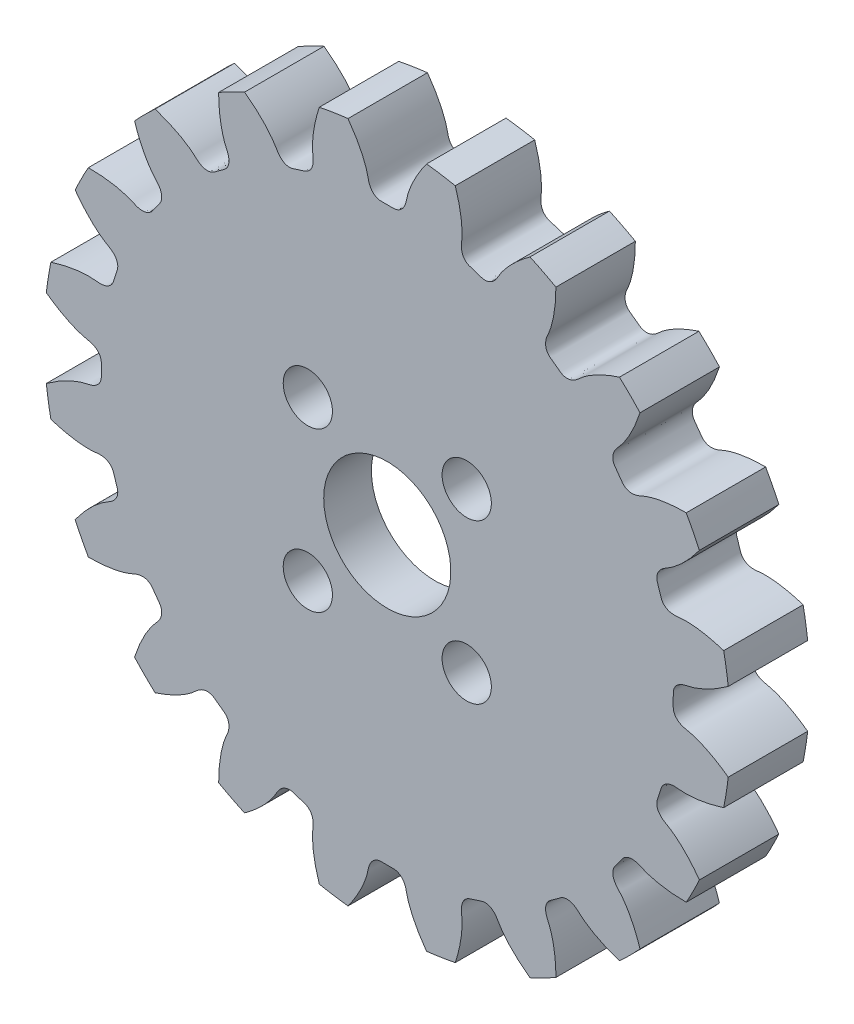
from build123d import *

# Parameters (mm, degrees)
SKETCHREVOLVESPURGEAR1_W       = 20
SKETCHREVOLVESPURGEAR1_H       = 21.599999676
TOOTHEXTRUDECUTSPURGEAR1_DEPTH = 10
PATTERNSPURGEAR1_COUNT         = 20
BOREREVOLVESKETCH_W            = 20
BOREREVOLVESKETCH_H            = 5
SKETCH_5_R                     = 5
EXTRUDE_1_DEPTH                = 10
SKETCH_6_R                     = 21.599999676
CUT_EXTRUDE_3_DEPTH            = 15
SKETCH_8_R                     = 10.5
CUT_EXTRUDE_4_DEPTH            = 2
SKETCH_9_R                     = 1.55
SKETCH_9_R_2                   = 4
CUT_EXTRUDE_6_DEPTH            = 31.494177986


with BuildPart() as part:
    # SketchRevolveSpurGear1 → SpurGear1 (revolve)
    with BuildSketch(Plane(origin=(0, 0, 0), x_dir=(0, 0, -1), z_dir=(1, 0, 0))):
        with Locations((0, 10.799999838)):
            Rectangle(SKETCHREVOLVESPURGEAR1_W, SKETCHREVOLVESPURGEAR1_H)
    revolve(axis=Axis((0, 0, 0), (0, 0, -1)))

    # SketchToothSpurGear1 → ToothExtrudeCutSpurGear1 (cut, symmetric)
    with BuildSketch(Plane.XY):
        with BuildLine():
            ThreePointArc((21.532230647, 2.526940688), (21.679999674, 0), (21.532230647, -2.526940688))
            add(Edge.make_bspline(
                [(21.532230647, -2.526940688), (21.301390631, -2.355599127), (20.993144013, -2.145043773), (20.604048565, -1.912590907), (20.393800428, -1.795045634), (20.194039766, -1.690777215), (20.00534497, -1.59908019), (19.828262151, -1.519226163), (19.663304554, -1.450466874), (19.510951931, -1.392032618), (19.371649371, -1.343142192), (19.245808271, -1.302976738), (19.133800685, -1.270767763), (19.035974432, -1.245531154), (18.869684481, -1.208311641), (18.704798317, -1.178558703), (18.546736061, -1.119890043), (18.463392394, -1.082598154), (18.380456666, -1.036979758), (18.296968655, -0.980015425), (18.212792281, -0.906884989), (18.130131288, -0.811131279), (18.056248596, -0.686346334), (18.007102294, -0.538421983), (17.987222236, -0.30506447), (18.009084117, 0), (17.987222236, 0.30506447), (18.007102294, 0.538421983), (18.056248596, 0.686346334), (18.130131288, 0.811131279), (18.212792281, 0.906884989), (18.296968655, 0.980015425), (18.380456666, 1.036979758), (18.463392394, 1.082598154), (18.546736061, 1.119890043), (18.704798317, 1.178558703), (18.869684481, 1.208311641), (19.035974432, 1.245531154), (19.133800685, 1.270767763), (19.245808271, 1.302976738), (19.371649371, 1.343142192), (19.510951931, 1.392032618), (19.663304554, 1.450466874), (19.828262151, 1.519226163), (20.00534497, 1.59908019), (20.194039766, 1.690777215), (20.393800428, 1.795045634), (20.604048565, 1.912590907), (20.993144013, 2.145043773), (21.301390631, 2.355599127), (21.532230647, 2.526940688)],
                knots=[0, 0, 0, 0, 0.091955383, 0.119295403, 0.144978451, 0.169004529, 0.191373636, 0.212085772, 0.231140937, 0.248539131, 0.264280355, 0.278364608, 0.29079189, 0.301562201, 0.310675542, 0.345325143, 0.354890581, 0.36454229, 0.374514974, 0.385130901, 0.396817927, 0.410091421, 0.425426365, 0.442936085, 0.459429389, 0.5, 0.540570611, 0.557063915, 0.574573635, 0.589908579, 0.603182073, 0.614869099, 0.625485026, 0.63545771, 0.645109419, 0.654674857, 0.689324458, 0.698437799, 0.70920811, 0.721635392, 0.735719645, 0.751460869, 0.768859063, 0.787914228, 0.808626364, 0.830995471, 0.855021549, 0.880704597, 0.908044617, 1, 1, 1, 1], degree=3))
        make_face()
    toothextrudecutspurgear1 = extrude(amount=TOOTHEXTRUDECUTSPURGEAR1_DEPTH, both=True, mode=Mode.SUBTRACT)

    # PatternSpurGear1: ToothExtrudeCutSpurGear1 ×20 about axis
    patternspurgear1_axis = Axis((0, 0, 55), (0, 0, -1))
    for i in range(1, PATTERNSPURGEAR1_COUNT):
        add(toothextrudecutspurgear1.rotate(patternspurgear1_axis, i * 360 / PATTERNSPURGEAR1_COUNT), mode=Mode.SUBTRACT)

    # BoreRevolveSketch → BoreRevolveCut (revolve, cut)
    with BuildSketch(Plane(origin=(0, 0, 0), x_dir=(0, 0, -1), z_dir=(1, 0, 0))):
        with Locations((0, 2.5)):
            Rectangle(BOREREVOLVESKETCH_W, BOREREVOLVESKETCH_H)
    revolve(axis=Axis((0, 0, 0), (0, 0, -1)), mode=Mode.SUBTRACT)

    # 草图5 → 凸台-拉伸1 (add)
    with BuildSketch(Plane.XY.offset(10)):
        Circle(SKETCH_5_R)
    extrude(amount=-EXTRUDE_1_DEPTH)

    # 草图6 → 切除-拉伸3 (cut)
    with BuildSketch(Plane(origin=(0, 0, -10), x_dir=(-1, 0, 0), z_dir=(0, 0, -1))):
        Circle(SKETCH_6_R)
    extrude(amount=-CUT_EXTRUDE_3_DEPTH, mode=Mode.SUBTRACT)

    # 草图8 → 切除-拉伸4 (cut)
    with BuildSketch(Plane(origin=(0, 0, 5), x_dir=(-1, 0, 0), z_dir=(0, 0, -1))):
        Circle(SKETCH_8_R)
    extrude(amount=-CUT_EXTRUDE_4_DEPTH, mode=Mode.SUBTRACT)

    # 草图9 → 切除-拉伸6 (cut, through all)
    with BuildSketch(Plane(origin=(0, 0, 7), x_dir=(-1, 0, 0), z_dir=(0, 0, -1))):
        with Locations((-5, -5)):
            Circle(SKETCH_9_R)
        with Locations((5, -5)):
            Circle(SKETCH_9_R)
        with Locations((-5, 5)):
            Circle(SKETCH_9_R)
        with Locations((5, 5)):
            Circle(SKETCH_9_R)
        Circle(SKETCH_9_R_2)
    extrude(amount=-CUT_EXTRUDE_6_DEPTH, mode=Mode.SUBTRACT)


solid = part.part
